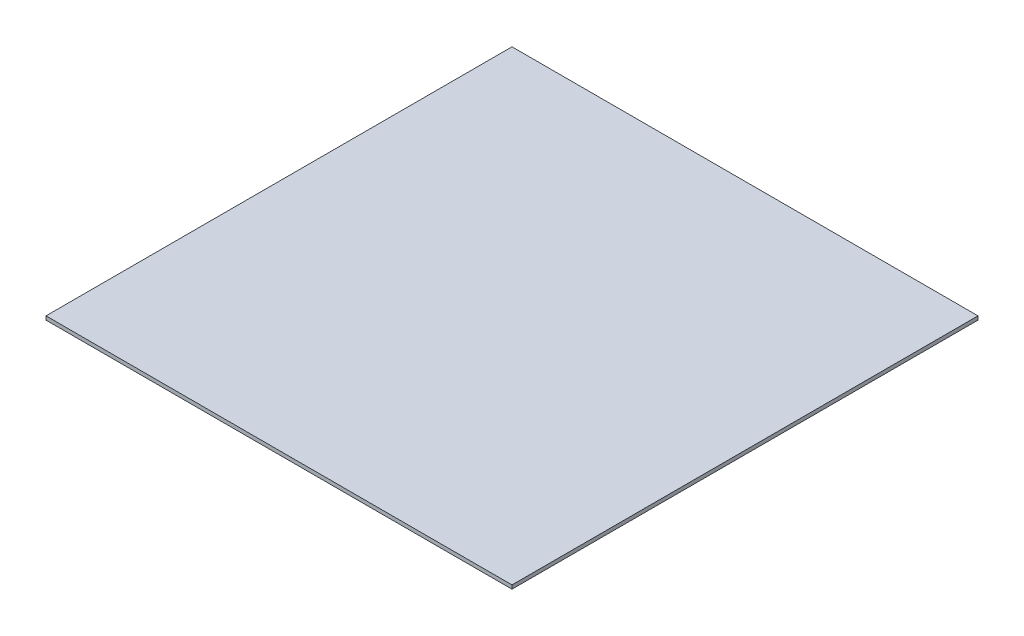
from build123d import *

# Parameters (mm, degrees)
SKETCH1_W           = 500
SKETCH1_H           = 500
BOSS_EXTRUDE1_DEPTH = 4
SKETCH2_W           = 492
SKETCH2_H           = 492
BOSS_EXTRUDE2_DEPTH = 4


with BuildPart() as part:
    # Sketch1 → Boss-Extrude1 (new body)
    with BuildSketch(Plane(origin=(0, 0, 0), x_dir=(1, 0, 0), z_dir=(0, 1, 0))):
        Rectangle(SKETCH1_W, SKETCH1_H)
    extrude(amount=BOSS_EXTRUDE1_DEPTH)

    # Sketch2 → Boss-Extrude2 (add)
    with BuildSketch(Plane(origin=(0, 0, 0), x_dir=(-1, 0, 0), z_dir=(0, -1, 0))):
        Rectangle(SKETCH2_W, SKETCH2_H)
    extrude(amount=BOSS_EXTRUDE2_DEPTH)


solid = part.part
